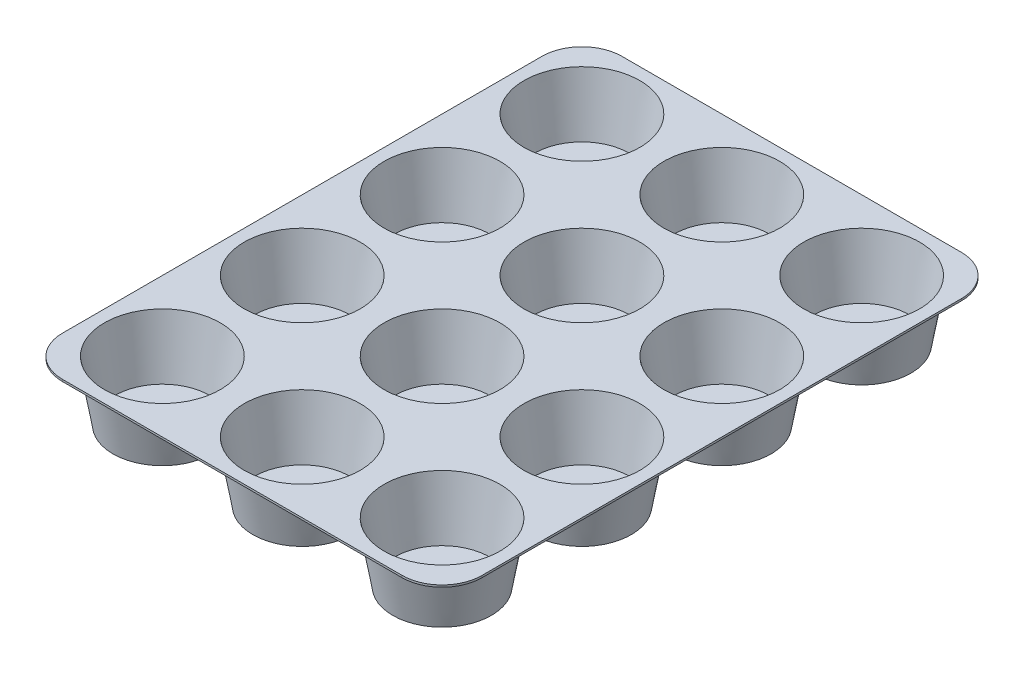
from build123d import *

# Parameters (mm, degrees)
SKETCH1_W                  = 266.7
SKETCH1_H                  = 355.6
BOSS_EXTRUDE1_DEPTH        = 1.27
SKETCH2_R                  = 38.1
BOSS_EXTRUDE3_DEPTH        = 38.1
BOSS_EXTRUDE3_DRAFT        = -10
SKETCH5_R                  = 36.83
CUT_EXTRUDE2_DEPTH         = 36.83
CUT_EXTRUDE2_DRAFT         = -10
LPATTERN1_COPY_1_SKETCH_R  = 38.1
LPATTERN1_COPY_1_DEPTH     = 38.1
LPATTERN1_COPY_1_DRAFT     = -10
LPATTERN1_COPY_2_SKETCH_R  = 38.1
LPATTERN1_COPY_2_DEPTH     = 38.1
LPATTERN1_COPY_2_DRAFT     = -10
LPATTERN1_COPY_3_SKETCH_R  = 38.1
LPATTERN1_COPY_3_DEPTH     = 38.1
LPATTERN1_COPY_3_DRAFT     = -10
LPATTERN1_COPY_4_SKETCH_R  = 38.1
LPATTERN1_COPY_4_DEPTH     = 38.1
LPATTERN1_COPY_4_DRAFT     = -10
LPATTERN1_COPY_5_SKETCH_R  = 38.1
LPATTERN1_COPY_5_DEPTH     = 38.1
LPATTERN1_COPY_5_DRAFT     = -10
LPATTERN1_COPY_6_SKETCH_R  = 38.1
LPATTERN1_COPY_6_DEPTH     = 38.1
LPATTERN1_COPY_6_DRAFT     = -10
LPATTERN1_COPY_7_SKETCH_R  = 38.1
LPATTERN1_COPY_7_DEPTH     = 38.1
LPATTERN1_COPY_7_DRAFT     = -10
LPATTERN1_COPY_8_SKETCH_R  = 38.1
LPATTERN1_COPY_8_DEPTH     = 38.1
LPATTERN1_COPY_8_DRAFT     = -10
LPATTERN1_COPY_9_SKETCH_R  = 38.1
LPATTERN1_COPY_9_DEPTH     = 38.1
LPATTERN1_COPY_9_DRAFT     = -10
LPATTERN1_COPY_10_SKETCH_R = 38.1
LPATTERN1_COPY_10_DEPTH    = 38.1
LPATTERN1_COPY_10_DRAFT    = -10
LPATTERN1_COPY_11_SKETCH_R = 38.1
LPATTERN1_COPY_11_DEPTH    = 38.1
LPATTERN1_COPY_11_DRAFT    = -10
LPATTERN1_COPY_12_SKETCH_R = 36.83
LPATTERN1_COPY_12_DEPTH    = 36.83
LPATTERN1_COPY_12_DRAFT    = -10
LPATTERN1_COPY_13_SKETCH_R = 36.83
LPATTERN1_COPY_13_DEPTH    = 36.83
LPATTERN1_COPY_13_DRAFT    = -10
LPATTERN1_COPY_14_SKETCH_R = 36.83
LPATTERN1_COPY_14_DEPTH    = 36.83
LPATTERN1_COPY_14_DRAFT    = -10
LPATTERN1_COPY_15_SKETCH_R = 36.83
LPATTERN1_COPY_15_DEPTH    = 36.83
LPATTERN1_COPY_15_DRAFT    = -10
LPATTERN1_COPY_16_SKETCH_R = 36.83
LPATTERN1_COPY_16_DEPTH    = 36.83
LPATTERN1_COPY_16_DRAFT    = -10
LPATTERN1_COPY_17_SKETCH_R = 36.83
LPATTERN1_COPY_17_DEPTH    = 36.83
LPATTERN1_COPY_17_DRAFT    = -10
LPATTERN1_COPY_18_SKETCH_R = 36.83
LPATTERN1_COPY_18_DEPTH    = 36.83
LPATTERN1_COPY_18_DRAFT    = -10
LPATTERN1_COPY_19_SKETCH_R = 36.83
LPATTERN1_COPY_19_DEPTH    = 36.83
LPATTERN1_COPY_19_DRAFT    = -10
LPATTERN1_COPY_20_SKETCH_R = 36.83
LPATTERN1_COPY_20_DEPTH    = 36.83
LPATTERN1_COPY_20_DRAFT    = -10
LPATTERN1_COPY_21_SKETCH_R = 36.83
LPATTERN1_COPY_21_DEPTH    = 36.83
LPATTERN1_COPY_21_DRAFT    = -10
LPATTERN1_COPY_22_SKETCH_R = 36.83
LPATTERN1_COPY_22_DEPTH    = 36.83
LPATTERN1_COPY_22_DRAFT    = -10
FILLET1_R                  = 25.4


with BuildPart() as part:
    # Sketch1 → Boss-Extrude1 (new body)
    with BuildSketch(Plane(origin=(0, 0, 0), x_dir=(1, 0, 0), z_dir=(0, 1, 0))):
        Rectangle(SKETCH1_W, SKETCH1_H)
    extrude(amount=BOSS_EXTRUDE1_DEPTH)


with BuildPart() as boss_extrude3_tool:
    # Sketch2 → Boss-Extrude3 (with draft: the straight prism first)
    with BuildSketch(Plane(origin=(0, 1.27, 0), x_dir=(1, 0, 0), z_dir=(0, 1, 0))):
        with Locations((-88.9, 133.35)):
            Circle(SKETCH2_R)
    extrude(amount=-BOSS_EXTRUDE3_DEPTH)
    # Boss-Extrude3: the draft: its side faces are tilted about the plane it starts from
    boss_extrude3_sides = [boss_extrude3_tool.faces().sort_by_distance(p)[0] for p in [
        (-127, -17.78, -133.35),
    ]]
    draft(boss_extrude3_sides, Plane(origin=(0, 1.27, 0), x_dir=(1, 0, 0), z_dir=(0, 1, 0)), BOSS_EXTRUDE3_DRAFT)


with BuildPart() as part_1:
    add(part.part)

    # Boss-Extrude3: add boss_extrude3_tool
    add(boss_extrude3_tool.part)


with BuildPart() as cut_extrude2_tool:
    # Sketch5 → Cut-Extrude2 (with draft: the straight prism first)
    with BuildSketch(Plane(origin=(0, 1.27, 0), x_dir=(1, 0, 0), z_dir=(0, 1, 0))):
        with Locations((-88.9, 133.35)):
            Circle(SKETCH5_R)
    extrude(amount=-CUT_EXTRUDE2_DEPTH)
    # Cut-Extrude2: the draft: its side faces are tilted about the plane it starts from
    cut_extrude2_sides = [cut_extrude2_tool.faces().sort_by_distance(p)[0] for p in [
        (-125.73, -17.145, -133.35),
    ]]
    draft(cut_extrude2_sides, Plane(origin=(0, 1.27, 0), x_dir=(1, 0, 0), z_dir=(0, 1, 0)), CUT_EXTRUDE2_DRAFT)


with BuildPart() as part_2:
    add(part_1.part)

    # Cut-Extrude2: cut by cut_extrude2_tool
    add(cut_extrude2_tool.part, mode=Mode.SUBTRACT)


with BuildPart() as lpattern1_copy_1_tool:
    # LPattern1 copy 1 sketch → LPattern1 copy 1 (with draft: the straight prism first)
    with BuildSketch(Plane(origin=(0, 1.27, 88.9), x_dir=(1, 0, 0), z_dir=(0, 1, 0))):
        with Locations((-88.9, 133.35)):
            Circle(LPATTERN1_COPY_1_SKETCH_R)
    extrude(amount=-LPATTERN1_COPY_1_DEPTH)
    # LPattern1 copy 1: the draft: its side faces are tilted about the plane it starts from
    lpattern1_copy_1_sides = [lpattern1_copy_1_tool.faces().sort_by_distance(p)[0] for p in [
        (-127, -17.78, -44.45),
    ]]
    draft(lpattern1_copy_1_sides, Plane(origin=(0, 1.27, 88.9), x_dir=(1, 0, 0), z_dir=(0, 1, 0)), LPATTERN1_COPY_1_DRAFT)


with BuildPart() as part_3:
    add(part_2.part)

    # LPattern1 copy 1: add lpattern1_copy_1_tool
    add(lpattern1_copy_1_tool.part)


with BuildPart() as lpattern1_copy_2_tool:
    # LPattern1 copy 2 sketch → LPattern1 copy 2 (with draft: the straight prism first)
    with BuildSketch(Plane(origin=(0, 1.27, 177.8), x_dir=(1, 0, 0), z_dir=(0, 1, 0))):
        with Locations((-88.9, 133.35)):
            Circle(LPATTERN1_COPY_2_SKETCH_R)
    extrude(amount=-LPATTERN1_COPY_2_DEPTH)
    # LPattern1 copy 2: the draft: its side faces are tilted about the plane it starts from
    lpattern1_copy_2_sides = [lpattern1_copy_2_tool.faces().sort_by_distance(p)[0] for p in [
        (-127, -17.78, 44.45),
    ]]
    draft(lpattern1_copy_2_sides, Plane(origin=(0, 1.27, 177.8), x_dir=(1, 0, 0), z_dir=(0, 1, 0)), LPATTERN1_COPY_2_DRAFT)


with BuildPart() as part_4:
    add(part_3.part)

    # LPattern1 copy 2: add lpattern1_copy_2_tool
    add(lpattern1_copy_2_tool.part)


with BuildPart() as lpattern1_copy_3_tool:
    # LPattern1 copy 3 sketch → LPattern1 copy 3 (with draft: the straight prism first)
    with BuildSketch(Plane(origin=(0, 1.27, 266.7), x_dir=(1, 0, 0), z_dir=(0, 1, 0))):
        with Locations((-88.9, 133.35)):
            Circle(LPATTERN1_COPY_3_SKETCH_R)
    extrude(amount=-LPATTERN1_COPY_3_DEPTH)
    # LPattern1 copy 3: the draft: its side faces are tilted about the plane it starts from
    lpattern1_copy_3_sides = [lpattern1_copy_3_tool.faces().sort_by_distance(p)[0] for p in [
        (-127, -17.78, 133.35),
    ]]
    draft(lpattern1_copy_3_sides, Plane(origin=(0, 1.27, 266.7), x_dir=(1, 0, 0), z_dir=(0, 1, 0)), LPATTERN1_COPY_3_DRAFT)


with BuildPart() as part_5:
    add(part_4.part)

    # LPattern1 copy 3: add lpattern1_copy_3_tool
    add(lpattern1_copy_3_tool.part)


with BuildPart() as lpattern1_copy_4_tool:
    # LPattern1 copy 4 sketch → LPattern1 copy 4 (with draft: the straight prism first)
    with BuildSketch(Plane(origin=(88.9, 1.27, 0), x_dir=(1, 0, 0), z_dir=(0, 1, 0))):
        with Locations((-88.9, 133.35)):
            Circle(LPATTERN1_COPY_4_SKETCH_R)
    extrude(amount=-LPATTERN1_COPY_4_DEPTH)
    # LPattern1 copy 4: the draft: its side faces are tilted about the plane it starts from
    lpattern1_copy_4_sides = [lpattern1_copy_4_tool.faces().sort_by_distance(p)[0] for p in [
        (-38.1, -17.78, -133.35),
    ]]
    draft(lpattern1_copy_4_sides, Plane(origin=(88.9, 1.27, 0), x_dir=(1, 0, 0), z_dir=(0, 1, 0)), LPATTERN1_COPY_4_DRAFT)


with BuildPart() as part_6:
    add(part_5.part)

    # LPattern1 copy 4: add lpattern1_copy_4_tool
    add(lpattern1_copy_4_tool.part)


with BuildPart() as lpattern1_copy_5_tool:
    # LPattern1 copy 5 sketch → LPattern1 copy 5 (with draft: the straight prism first)
    with BuildSketch(Plane(origin=(88.9, 1.27, 88.9), x_dir=(1, 0, 0), z_dir=(0, 1, 0))):
        with Locations((-88.9, 133.35)):
            Circle(LPATTERN1_COPY_5_SKETCH_R)
    extrude(amount=-LPATTERN1_COPY_5_DEPTH)
    # LPattern1 copy 5: the draft: its side faces are tilted about the plane it starts from
    lpattern1_copy_5_sides = [lpattern1_copy_5_tool.faces().sort_by_distance(p)[0] for p in [
        (-38.1, -17.78, -44.45),
    ]]
    draft(lpattern1_copy_5_sides, Plane(origin=(88.9, 1.27, 88.9), x_dir=(1, 0, 0), z_dir=(0, 1, 0)), LPATTERN1_COPY_5_DRAFT)


with BuildPart() as part_7:
    add(part_6.part)

    # LPattern1 copy 5: add lpattern1_copy_5_tool
    add(lpattern1_copy_5_tool.part)


with BuildPart() as lpattern1_copy_6_tool:
    # LPattern1 copy 6 sketch → LPattern1 copy 6 (with draft: the straight prism first)
    with BuildSketch(Plane(origin=(88.9, 1.27, 177.8), x_dir=(1, 0, 0), z_dir=(0, 1, 0))):
        with Locations((-88.9, 133.35)):
            Circle(LPATTERN1_COPY_6_SKETCH_R)
    extrude(amount=-LPATTERN1_COPY_6_DEPTH)
    # LPattern1 copy 6: the draft: its side faces are tilted about the plane it starts from
    lpattern1_copy_6_sides = [lpattern1_copy_6_tool.faces().sort_by_distance(p)[0] for p in [
        (-38.1, -17.78, 44.45),
    ]]
    draft(lpattern1_copy_6_sides, Plane(origin=(88.9, 1.27, 177.8), x_dir=(1, 0, 0), z_dir=(0, 1, 0)), LPATTERN1_COPY_6_DRAFT)


with BuildPart() as part_8:
    add(part_7.part)

    # LPattern1 copy 6: add lpattern1_copy_6_tool
    add(lpattern1_copy_6_tool.part)


with BuildPart() as lpattern1_copy_7_tool:
    # LPattern1 copy 7 sketch → LPattern1 copy 7 (with draft: the straight prism first)
    with BuildSketch(Plane(origin=(88.9, 1.27, 266.7), x_dir=(1, 0, 0), z_dir=(0, 1, 0))):
        with Locations((-88.9, 133.35)):
            Circle(LPATTERN1_COPY_7_SKETCH_R)
    extrude(amount=-LPATTERN1_COPY_7_DEPTH)
    # LPattern1 copy 7: the draft: its side faces are tilted about the plane it starts from
    lpattern1_copy_7_sides = [lpattern1_copy_7_tool.faces().sort_by_distance(p)[0] for p in [
        (-38.1, -17.78, 133.35),
    ]]
    draft(lpattern1_copy_7_sides, Plane(origin=(88.9, 1.27, 266.7), x_dir=(1, 0, 0), z_dir=(0, 1, 0)), LPATTERN1_COPY_7_DRAFT)


with BuildPart() as part_9:
    add(part_8.part)

    # LPattern1 copy 7: add lpattern1_copy_7_tool
    add(lpattern1_copy_7_tool.part)


with BuildPart() as lpattern1_copy_8_tool:
    # LPattern1 copy 8 sketch → LPattern1 copy 8 (with draft: the straight prism first)
    with BuildSketch(Plane(origin=(177.8, 1.27, 0), x_dir=(1, 0, 0), z_dir=(0, 1, 0))):
        with Locations((-88.9, 133.35)):
            Circle(LPATTERN1_COPY_8_SKETCH_R)
    extrude(amount=-LPATTERN1_COPY_8_DEPTH)
    # LPattern1 copy 8: the draft: its side faces are tilted about the plane it starts from
    lpattern1_copy_8_sides = [lpattern1_copy_8_tool.faces().sort_by_distance(p)[0] for p in [
        (50.8, -17.78, -133.35),
    ]]
    draft(lpattern1_copy_8_sides, Plane(origin=(177.8, 1.27, 0), x_dir=(1, 0, 0), z_dir=(0, 1, 0)), LPATTERN1_COPY_8_DRAFT)


with BuildPart() as part_10:
    add(part_9.part)

    # LPattern1 copy 8: add lpattern1_copy_8_tool
    add(lpattern1_copy_8_tool.part)


with BuildPart() as lpattern1_copy_9_tool:
    # LPattern1 copy 9 sketch → LPattern1 copy 9 (with draft: the straight prism first)
    with BuildSketch(Plane(origin=(177.8, 1.27, 88.9), x_dir=(1, 0, 0), z_dir=(0, 1, 0))):
        with Locations((-88.9, 133.35)):
            Circle(LPATTERN1_COPY_9_SKETCH_R)
    extrude(amount=-LPATTERN1_COPY_9_DEPTH)
    # LPattern1 copy 9: the draft: its side faces are tilted about the plane it starts from
    lpattern1_copy_9_sides = [lpattern1_copy_9_tool.faces().sort_by_distance(p)[0] for p in [
        (50.8, -17.78, -44.45),
    ]]
    draft(lpattern1_copy_9_sides, Plane(origin=(177.8, 1.27, 88.9), x_dir=(1, 0, 0), z_dir=(0, 1, 0)), LPATTERN1_COPY_9_DRAFT)


with BuildPart() as part_11:
    add(part_10.part)

    # LPattern1 copy 9: add lpattern1_copy_9_tool
    add(lpattern1_copy_9_tool.part)


with BuildPart() as lpattern1_copy_10_tool:
    # LPattern1 copy 10 sketch → LPattern1 copy 10 (with draft: the straight prism first)
    with BuildSketch(Plane(origin=(177.8, 1.27, 177.8), x_dir=(1, 0, 0), z_dir=(0, 1, 0))):
        with Locations((-88.9, 133.35)):
            Circle(LPATTERN1_COPY_10_SKETCH_R)
    extrude(amount=-LPATTERN1_COPY_10_DEPTH)
    # LPattern1 copy 10: the draft: its side faces are tilted about the plane it starts from
    lpattern1_copy_10_sides = [lpattern1_copy_10_tool.faces().sort_by_distance(p)[0] for p in [
        (50.8, -17.78, 44.45),
    ]]
    draft(lpattern1_copy_10_sides, Plane(origin=(177.8, 1.27, 177.8), x_dir=(1, 0, 0), z_dir=(0, 1, 0)), LPATTERN1_COPY_10_DRAFT)


with BuildPart() as part_12:
    add(part_11.part)

    # LPattern1 copy 10: add lpattern1_copy_10_tool
    add(lpattern1_copy_10_tool.part)


with BuildPart() as lpattern1_copy_11_tool:
    # LPattern1 copy 11 sketch → LPattern1 copy 11 (with draft: the straight prism first)
    with BuildSketch(Plane(origin=(177.8, 1.27, 266.7), x_dir=(1, 0, 0), z_dir=(0, 1, 0))):
        with Locations((-88.9, 133.35)):
            Circle(LPATTERN1_COPY_11_SKETCH_R)
    extrude(amount=-LPATTERN1_COPY_11_DEPTH)
    # LPattern1 copy 11: the draft: its side faces are tilted about the plane it starts from
    lpattern1_copy_11_sides = [lpattern1_copy_11_tool.faces().sort_by_distance(p)[0] for p in [
        (50.8, -17.78, 133.35),
    ]]
    draft(lpattern1_copy_11_sides, Plane(origin=(177.8, 1.27, 266.7), x_dir=(1, 0, 0), z_dir=(0, 1, 0)), LPATTERN1_COPY_11_DRAFT)


with BuildPart() as part_13:
    add(part_12.part)

    # LPattern1 copy 11: add lpattern1_copy_11_tool
    add(lpattern1_copy_11_tool.part)


with BuildPart() as lpattern1_copy_12_tool:
    # LPattern1 copy 12 sketch → LPattern1 copy 12 (with draft: the straight prism first)
    with BuildSketch(Plane(origin=(0, 1.27, 88.9), x_dir=(1, 0, 0), z_dir=(0, 1, 0))):
        with Locations((-88.9, 133.35)):
            Circle(LPATTERN1_COPY_12_SKETCH_R)
    extrude(amount=-LPATTERN1_COPY_12_DEPTH)
    # LPattern1 copy 12: the draft: its side faces are tilted about the plane it starts from
    lpattern1_copy_12_sides = [lpattern1_copy_12_tool.faces().sort_by_distance(p)[0] for p in [
        (-125.73, -17.145, -44.45),
    ]]
    draft(lpattern1_copy_12_sides, Plane(origin=(0, 1.27, 88.9), x_dir=(1, 0, 0), z_dir=(0, 1, 0)), LPATTERN1_COPY_12_DRAFT)


with BuildPart() as part_14:
    add(part_13.part)

    # LPattern1 copy 12: cut by lpattern1_copy_12_tool
    add(lpattern1_copy_12_tool.part, mode=Mode.SUBTRACT)


with BuildPart() as lpattern1_copy_13_tool:
    # LPattern1 copy 13 sketch → LPattern1 copy 13 (with draft: the straight prism first)
    with BuildSketch(Plane(origin=(0, 1.27, 177.8), x_dir=(1, 0, 0), z_dir=(0, 1, 0))):
        with Locations((-88.9, 133.35)):
            Circle(LPATTERN1_COPY_13_SKETCH_R)
    extrude(amount=-LPATTERN1_COPY_13_DEPTH)
    # LPattern1 copy 13: the draft: its side faces are tilted about the plane it starts from
    lpattern1_copy_13_sides = [lpattern1_copy_13_tool.faces().sort_by_distance(p)[0] for p in [
        (-125.73, -17.145, 44.45),
    ]]
    draft(lpattern1_copy_13_sides, Plane(origin=(0, 1.27, 177.8), x_dir=(1, 0, 0), z_dir=(0, 1, 0)), LPATTERN1_COPY_13_DRAFT)


with BuildPart() as part_15:
    add(part_14.part)

    # LPattern1 copy 13: cut by lpattern1_copy_13_tool
    add(lpattern1_copy_13_tool.part, mode=Mode.SUBTRACT)


with BuildPart() as lpattern1_copy_14_tool:
    # LPattern1 copy 14 sketch → LPattern1 copy 14 (with draft: the straight prism first)
    with BuildSketch(Plane(origin=(0, 1.27, 266.7), x_dir=(1, 0, 0), z_dir=(0, 1, 0))):
        with Locations((-88.9, 133.35)):
            Circle(LPATTERN1_COPY_14_SKETCH_R)
    extrude(amount=-LPATTERN1_COPY_14_DEPTH)
    # LPattern1 copy 14: the draft: its side faces are tilted about the plane it starts from
    lpattern1_copy_14_sides = [lpattern1_copy_14_tool.faces().sort_by_distance(p)[0] for p in [
        (-125.73, -17.145, 133.35),
    ]]
    draft(lpattern1_copy_14_sides, Plane(origin=(0, 1.27, 266.7), x_dir=(1, 0, 0), z_dir=(0, 1, 0)), LPATTERN1_COPY_14_DRAFT)


with BuildPart() as part_16:
    add(part_15.part)

    # LPattern1 copy 14: cut by lpattern1_copy_14_tool
    add(lpattern1_copy_14_tool.part, mode=Mode.SUBTRACT)


with BuildPart() as lpattern1_copy_15_tool:
    # LPattern1 copy 15 sketch → LPattern1 copy 15 (with draft: the straight prism first)
    with BuildSketch(Plane(origin=(88.9, 1.27, 0), x_dir=(1, 0, 0), z_dir=(0, 1, 0))):
        with Locations((-88.9, 133.35)):
            Circle(LPATTERN1_COPY_15_SKETCH_R)
    extrude(amount=-LPATTERN1_COPY_15_DEPTH)
    # LPattern1 copy 15: the draft: its side faces are tilted about the plane it starts from
    lpattern1_copy_15_sides = [lpattern1_copy_15_tool.faces().sort_by_distance(p)[0] for p in [
        (-36.83, -17.145, -133.35),
    ]]
    draft(lpattern1_copy_15_sides, Plane(origin=(88.9, 1.27, 0), x_dir=(1, 0, 0), z_dir=(0, 1, 0)), LPATTERN1_COPY_15_DRAFT)


with BuildPart() as part_17:
    add(part_16.part)

    # LPattern1 copy 15: cut by lpattern1_copy_15_tool
    add(lpattern1_copy_15_tool.part, mode=Mode.SUBTRACT)


with BuildPart() as lpattern1_copy_16_tool:
    # LPattern1 copy 16 sketch → LPattern1 copy 16 (with draft: the straight prism first)
    with BuildSketch(Plane(origin=(88.9, 1.27, 88.9), x_dir=(1, 0, 0), z_dir=(0, 1, 0))):
        with Locations((-88.9, 133.35)):
            Circle(LPATTERN1_COPY_16_SKETCH_R)
    extrude(amount=-LPATTERN1_COPY_16_DEPTH)
    # LPattern1 copy 16: the draft: its side faces are tilted about the plane it starts from
    lpattern1_copy_16_sides = [lpattern1_copy_16_tool.faces().sort_by_distance(p)[0] for p in [
        (-36.83, -17.145, -44.45),
    ]]
    draft(lpattern1_copy_16_sides, Plane(origin=(88.9, 1.27, 88.9), x_dir=(1, 0, 0), z_dir=(0, 1, 0)), LPATTERN1_COPY_16_DRAFT)


with BuildPart() as part_18:
    add(part_17.part)

    # LPattern1 copy 16: cut by lpattern1_copy_16_tool
    add(lpattern1_copy_16_tool.part, mode=Mode.SUBTRACT)


with BuildPart() as lpattern1_copy_17_tool:
    # LPattern1 copy 17 sketch → LPattern1 copy 17 (with draft: the straight prism first)
    with BuildSketch(Plane(origin=(88.9, 1.27, 177.8), x_dir=(1, 0, 0), z_dir=(0, 1, 0))):
        with Locations((-88.9, 133.35)):
            Circle(LPATTERN1_COPY_17_SKETCH_R)
    extrude(amount=-LPATTERN1_COPY_17_DEPTH)
    # LPattern1 copy 17: the draft: its side faces are tilted about the plane it starts from
    lpattern1_copy_17_sides = [lpattern1_copy_17_tool.faces().sort_by_distance(p)[0] for p in [
        (-36.83, -17.145, 44.45),
    ]]
    draft(lpattern1_copy_17_sides, Plane(origin=(88.9, 1.27, 177.8), x_dir=(1, 0, 0), z_dir=(0, 1, 0)), LPATTERN1_COPY_17_DRAFT)


with BuildPart() as part_19:
    add(part_18.part)

    # LPattern1 copy 17: cut by lpattern1_copy_17_tool
    add(lpattern1_copy_17_tool.part, mode=Mode.SUBTRACT)


with BuildPart() as lpattern1_copy_18_tool:
    # LPattern1 copy 18 sketch → LPattern1 copy 18 (with draft: the straight prism first)
    with BuildSketch(Plane(origin=(88.9, 1.27, 266.7), x_dir=(1, 0, 0), z_dir=(0, 1, 0))):
        with Locations((-88.9, 133.35)):
            Circle(LPATTERN1_COPY_18_SKETCH_R)
    extrude(amount=-LPATTERN1_COPY_18_DEPTH)
    # LPattern1 copy 18: the draft: its side faces are tilted about the plane it starts from
    lpattern1_copy_18_sides = [lpattern1_copy_18_tool.faces().sort_by_distance(p)[0] for p in [
        (-36.83, -17.145, 133.35),
    ]]
    draft(lpattern1_copy_18_sides, Plane(origin=(88.9, 1.27, 266.7), x_dir=(1, 0, 0), z_dir=(0, 1, 0)), LPATTERN1_COPY_18_DRAFT)


with BuildPart() as part_20:
    add(part_19.part)

    # LPattern1 copy 18: cut by lpattern1_copy_18_tool
    add(lpattern1_copy_18_tool.part, mode=Mode.SUBTRACT)


with BuildPart() as lpattern1_copy_19_tool:
    # LPattern1 copy 19 sketch → LPattern1 copy 19 (with draft: the straight prism first)
    with BuildSketch(Plane(origin=(177.8, 1.27, 0), x_dir=(1, 0, 0), z_dir=(0, 1, 0))):
        with Locations((-88.9, 133.35)):
            Circle(LPATTERN1_COPY_19_SKETCH_R)
    extrude(amount=-LPATTERN1_COPY_19_DEPTH)
    # LPattern1 copy 19: the draft: its side faces are tilted about the plane it starts from
    lpattern1_copy_19_sides = [lpattern1_copy_19_tool.faces().sort_by_distance(p)[0] for p in [
        (52.07, -17.145, -133.35),
    ]]
    draft(lpattern1_copy_19_sides, Plane(origin=(177.8, 1.27, 0), x_dir=(1, 0, 0), z_dir=(0, 1, 0)), LPATTERN1_COPY_19_DRAFT)


with BuildPart() as part_21:
    add(part_20.part)

    # LPattern1 copy 19: cut by lpattern1_copy_19_tool
    add(lpattern1_copy_19_tool.part, mode=Mode.SUBTRACT)


with BuildPart() as lpattern1_copy_20_tool:
    # LPattern1 copy 20 sketch → LPattern1 copy 20 (with draft: the straight prism first)
    with BuildSketch(Plane(origin=(177.8, 1.27, 88.9), x_dir=(1, 0, 0), z_dir=(0, 1, 0))):
        with Locations((-88.9, 133.35)):
            Circle(LPATTERN1_COPY_20_SKETCH_R)
    extrude(amount=-LPATTERN1_COPY_20_DEPTH)
    # LPattern1 copy 20: the draft: its side faces are tilted about the plane it starts from
    lpattern1_copy_20_sides = [lpattern1_copy_20_tool.faces().sort_by_distance(p)[0] for p in [
        (52.07, -17.145, -44.45),
    ]]
    draft(lpattern1_copy_20_sides, Plane(origin=(177.8, 1.27, 88.9), x_dir=(1, 0, 0), z_dir=(0, 1, 0)), LPATTERN1_COPY_20_DRAFT)


with BuildPart() as part_22:
    add(part_21.part)

    # LPattern1 copy 20: cut by lpattern1_copy_20_tool
    add(lpattern1_copy_20_tool.part, mode=Mode.SUBTRACT)


with BuildPart() as lpattern1_copy_21_tool:
    # LPattern1 copy 21 sketch → LPattern1 copy 21 (with draft: the straight prism first)
    with BuildSketch(Plane(origin=(177.8, 1.27, 177.8), x_dir=(1, 0, 0), z_dir=(0, 1, 0))):
        with Locations((-88.9, 133.35)):
            Circle(LPATTERN1_COPY_21_SKETCH_R)
    extrude(amount=-LPATTERN1_COPY_21_DEPTH)
    # LPattern1 copy 21: the draft: its side faces are tilted about the plane it starts from
    lpattern1_copy_21_sides = [lpattern1_copy_21_tool.faces().sort_by_distance(p)[0] for p in [
        (52.07, -17.145, 44.45),
    ]]
    draft(lpattern1_copy_21_sides, Plane(origin=(177.8, 1.27, 177.8), x_dir=(1, 0, 0), z_dir=(0, 1, 0)), LPATTERN1_COPY_21_DRAFT)


with BuildPart() as part_23:
    add(part_22.part)

    # LPattern1 copy 21: cut by lpattern1_copy_21_tool
    add(lpattern1_copy_21_tool.part, mode=Mode.SUBTRACT)


with BuildPart() as lpattern1_copy_22_tool:
    # LPattern1 copy 22 sketch → LPattern1 copy 22 (with draft: the straight prism first)
    with BuildSketch(Plane(origin=(177.8, 1.27, 266.7), x_dir=(1, 0, 0), z_dir=(0, 1, 0))):
        with Locations((-88.9, 133.35)):
            Circle(LPATTERN1_COPY_22_SKETCH_R)
    extrude(amount=-LPATTERN1_COPY_22_DEPTH)
    # LPattern1 copy 22: the draft: its side faces are tilted about the plane it starts from
    lpattern1_copy_22_sides = [lpattern1_copy_22_tool.faces().sort_by_distance(p)[0] for p in [
        (52.07, -17.145, 133.35),
    ]]
    draft(lpattern1_copy_22_sides, Plane(origin=(177.8, 1.27, 266.7), x_dir=(1, 0, 0), z_dir=(0, 1, 0)), LPATTERN1_COPY_22_DRAFT)


with BuildPart() as part_24:
    add(part_23.part)

    # LPattern1 copy 22: cut by lpattern1_copy_22_tool
    add(lpattern1_copy_22_tool.part, mode=Mode.SUBTRACT)

    # Fillet1
    fillet1_edges = [part_24.edges().sort_by_distance(p)[0] for p in [
        (133.35, 0.635, 177.8),
        (-133.35, 0.635, 177.8),
        (-133.35, 0.635, -177.8),
        (133.35, 0.635, -177.8),
    ]]
    fillet(fillet1_edges, radius=FILLET1_R)


solid = part_24.part
